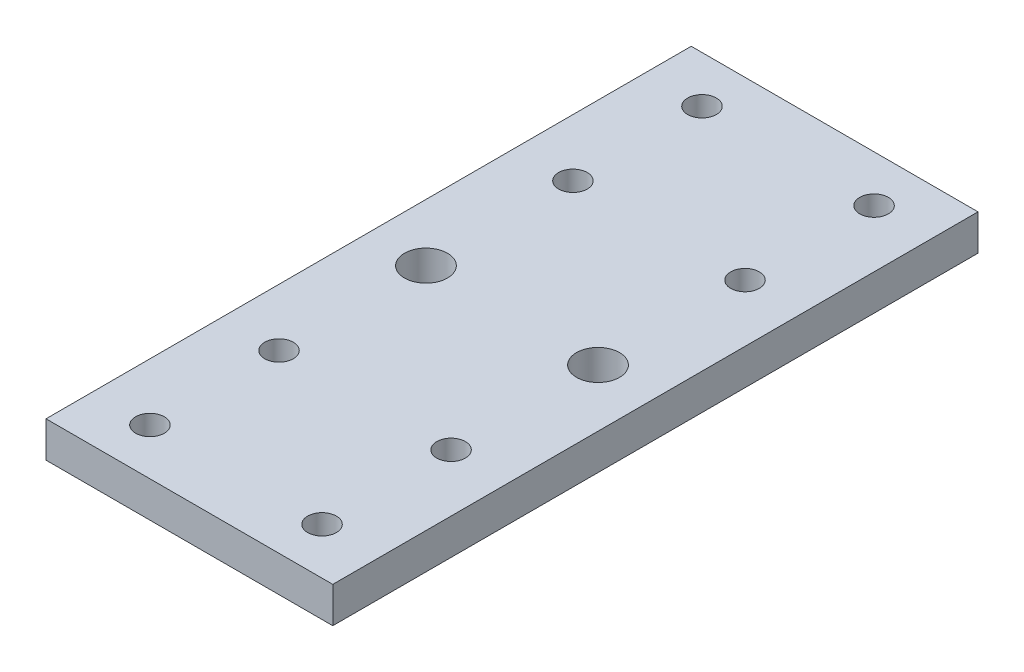
from build123d import *

# Parameters (mm, degrees)
SKETCH1_W           = 40
SKETCH1_H           = 90
SKETCH1_R           = 2
SKETCH1_R_2         = 3
BOSS_EXTRUDE1_DEPTH = 5


with BuildPart() as part:
    # Sketch1 → Boss-Extrude1 (new body)
    with BuildSketch(Plane(origin=(0, 0, 0), x_dir=(1, 0, 0), z_dir=(0, 1, 0))):
        Rectangle(SKETCH1_W, SKETCH1_H)
        with Locations(Location((-12, -38.5, 0), (0, 0, 270))):
            Circle(SKETCH1_R, mode=Mode.SUBTRACT)
        with Locations(Location((-12, -20.5, 0), (0, 0, 270))):
            Circle(SKETCH1_R, mode=Mode.SUBTRACT)
        with Locations(Location((-12, 20.5, 0), (0, 0, 270))):
            Circle(SKETCH1_R, mode=Mode.SUBTRACT)
        with Locations(Location((-12, 38.5, 0), (0, 0, 270))):
            Circle(SKETCH1_R, mode=Mode.SUBTRACT)
        with Locations(Location((12, 38.5, 0), (0, 0, 270))):
            Circle(SKETCH1_R, mode=Mode.SUBTRACT)
        with Locations(Location((12, -20.5, 0), (0, 0, 270))):
            Circle(SKETCH1_R, mode=Mode.SUBTRACT)
        with Locations(Location((12, -38.5, 0), (0, 0, 270))):
            Circle(SKETCH1_R, mode=Mode.SUBTRACT)
        with Locations(Location((12, 20.5, 0), (0, 0, 270))):
            Circle(SKETCH1_R, mode=Mode.SUBTRACT)
        with Locations(Location((-12, 0, 0), (0, 0, 270))):
            Circle(SKETCH1_R_2, mode=Mode.SUBTRACT)
        with Locations(Location((12, 0, 0), (0, 0, 90))):
            Circle(SKETCH1_R_2, mode=Mode.SUBTRACT)
    extrude(amount=BOSS_EXTRUDE1_DEPTH)


solid = part.part
